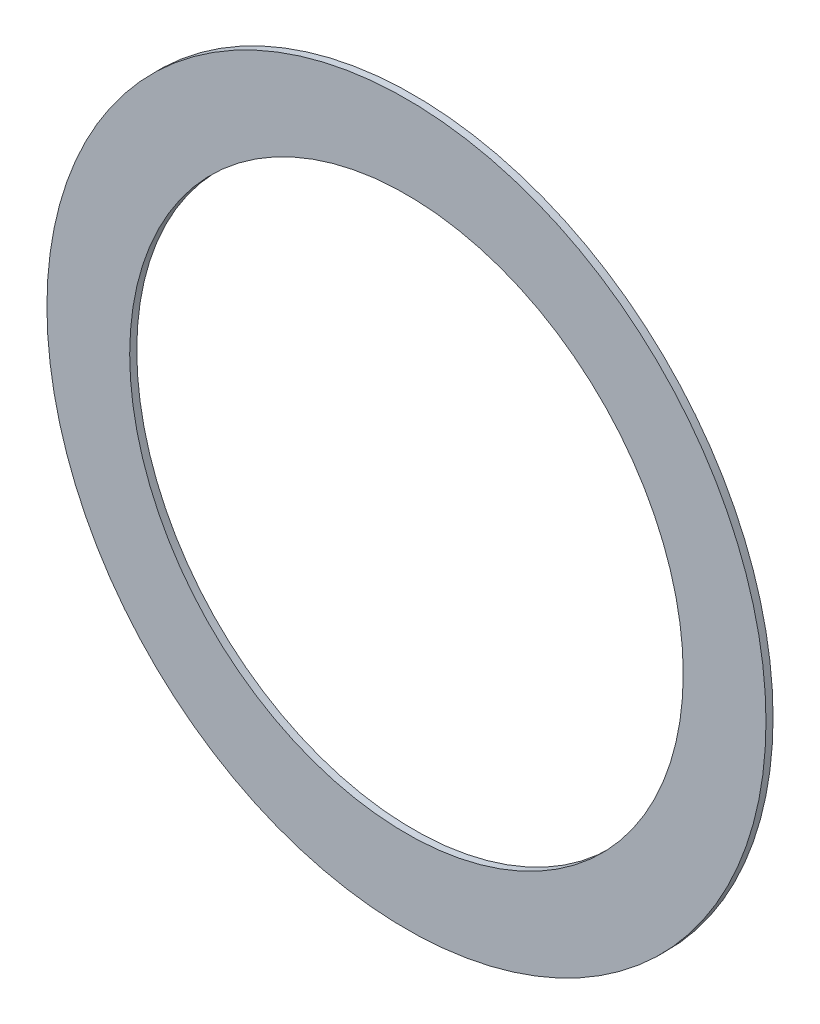
from build123d import *

# Parameters (mm, degrees)
BOSS_EXTRUDE1_DEPTH      = 0.4064
BOSS_EXTRUDE1_DEPTH_BACK = 0.4064
SKETCH3_R                = 41.275
SKETCH3_R_2              = 31.7754


with BuildPart() as part:
    # Sketch3 → Boss-Extrude1 (new, two sides: drawn at the far end of the back side and taken through both)
    with BuildSketch(Plane.XY.offset(-BOSS_EXTRUDE1_DEPTH_BACK)):
        Circle(SKETCH3_R)
        Circle(SKETCH3_R_2, mode=Mode.SUBTRACT)
    extrude(amount=BOSS_EXTRUDE1_DEPTH + BOSS_EXTRUDE1_DEPTH_BACK)


solid = part.part
